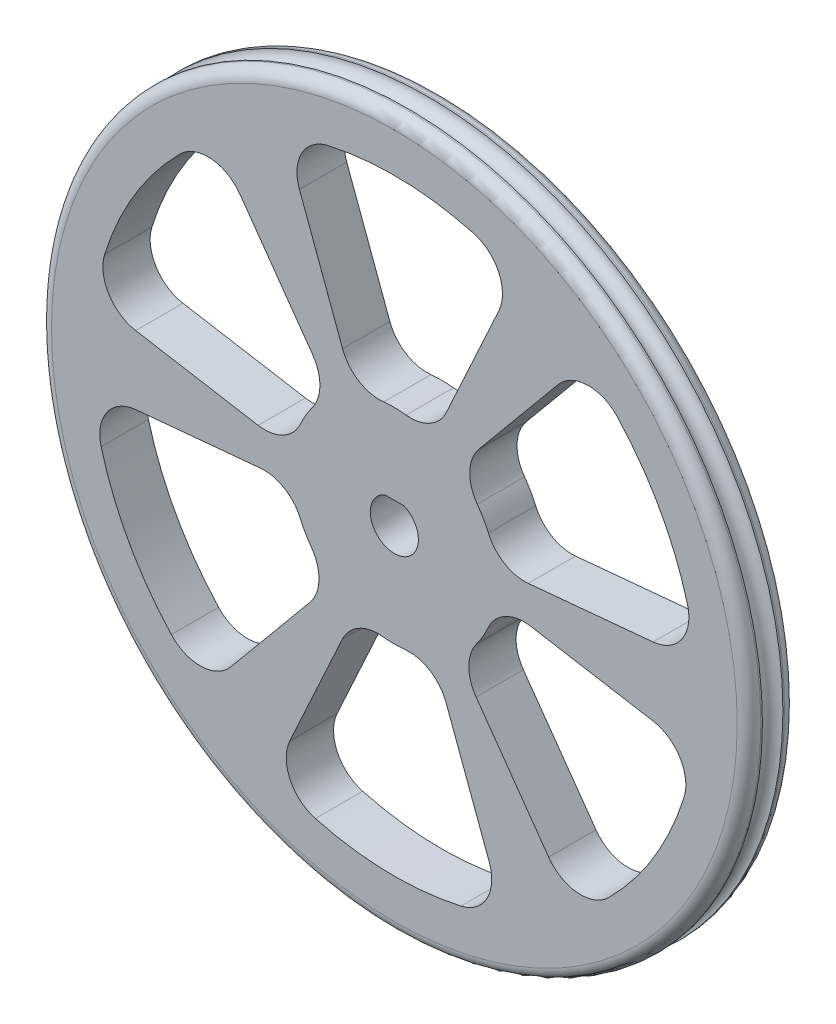
from build123d import *

# Parameters (mm, degrees)
ENL_V_MAT_EXTRU_3_DEPTH      = 64.710281815
ENL_V_MAT_EXTRU_3_DEPTH_BACK = 64.710281815
ENL_V_MAT_EXTRU_8_DEPTH      = 64.921827328
ENL_V_MAT_EXTRU_8_DEPTH_BACK = 64.921827328


with BuildPart() as part:
    # Esquisse2 → Révolution1 (revolve)
    with BuildSketch(Plane(origin=(0, 0, 0), x_dir=(0, 0, -1), z_dir=(1, 0, 0)), mode=Mode.PRIVATE) as r_volution1_sk:
        with BuildLine():
            Line((3, 0), (-3, 0))
            Line((-3, 0), (-3, 43.5))
            ThreePointArc((-3, 43.5), (-2.560660172, 44.560660172), (-1.5, 45))
            Line((-1.5, 45), (-1.3, 45))
            ThreePointArc((-1.3, 45), (0, 43.7), (1.3, 45))
            Line((1.3, 45), (1.5, 45))
            ThreePointArc((1.5, 45), (2.560660172, 44.560660172), (3, 43.5))
            Line((3, 43.5), (3, 0))
        make_face()
    revolve(r_volution1_sk.sketch.rotate(Axis((0, 0, 77.254476924), (0, 0, -1)), 90), axis=Axis((0, 0, 77.254476924), (0, 0, -1)))

    # Esquisse3 → Enlèv. mat.-Extru.3 (cut, two sides: drawn at the far end of the back side and taken through both)
    with BuildSketch(Plane.XY.offset(-ENL_V_MAT_EXTRU_3_DEPTH_BACK)):
        with BuildLine():
            Line((-1.209338662, 2.8), (1.209338662, 2.8))
            ThreePointArc((1.209338662, 2.8), (0, -3.05), (-1.209338662, 2.8))
        make_face()
    extrude(amount=ENL_V_MAT_EXTRU_3_DEPTH + ENL_V_MAT_EXTRU_3_DEPTH_BACK, mode=Mode.SUBTRACT)

    # Esquisse5 → Enlèv. mat.-Extru.8 (cut, two sides: drawn at the far end of the back side and taken through both)
    with BuildSketch(Plane.XY.offset(3).offset(-ENL_V_MAT_EXTRU_8_DEPTH_BACK)):
        with BuildLine():
            ThreePointArc((-10.434150973, 7.754256475), (-11.222640125, 6.561428855), (-11.875358384, 5.289221422))
            ThreePointArc((-11.875358384, 5.289221422), (-14.082795768, 2.915548976), (-17.282106883, 2.394483639))
            Line((-17.282106883, 2.394483639), (-32.821462414, 5.040473711))
            ThreePointArc((-32.821462414, 5.040473711), (-36.244832016, 7.356172767), (-36.755616081, 11.457516594))
            ThreePointArc((-36.755616081, 11.457516594), (-32.932247903, 19.942844532), (-27.184402598, 27.262763165))
            ThreePointArc((-27.184402598, 27.262763165), (-23.229227503, 28.704072082), (-19.575116576, 26.61403506))
            Line((-19.575116576, 26.61403506), (-10.368441836, 13.6285533))
            ThreePointArc((-10.368441836, 13.6285533), (-9.447598742, 10.680736947), (-10.434150973, 7.754256475))
        make_face()
        with BuildLine():
            ThreePointArc((-11.932458581, -5.159111572), (-11.293684136, -6.438377019), (-10.51827931, -7.639751328))
            ThreePointArc((-10.51827931, -7.639751328), (-9.566337363, -10.738284404), (-10.714737101, -13.769501772))
            Line((-10.714737101, -13.769501772), (-20.775909487, -25.903983384))
            ThreePointArc((-20.775909487, -25.903983384), (-24.493048499, -27.710858898), (-28.300308475, -26.102538961))
            ThreePointArc((-28.300308475, -26.102538961), (-33.73713394, -18.548741022), (-37.202446777, -9.911001654))
            ThreePointArc((-37.202446777, -9.911001654), (-36.473069367, -5.765065087), (-32.835988747, -3.645530707))
            Line((-32.835988747, -3.645530707), (-16.986894292, -2.165057378))
            ThreePointArc((-16.986894292, -2.165057378), (-13.973588898, -2.841492042), (-11.932458581, -5.159111572))
        make_face()
        with BuildLine():
            ThreePointArc((-1.498307609, -12.913368047), (-0.071044011, -12.999805873), (1.357079074, -12.928972751))
            ThreePointArc((1.357079074, -12.928972751), (4.516458405, -13.65383338), (6.567369781, -16.163985411))
            Line((6.567369781, -16.163985411), (12.045552926, -30.944457095))
            ThreePointArc((12.045552926, -30.944457095), (11.751783517, -35.067031665), (8.455307606, -37.560055555))
            ThreePointArc((8.455307606, -37.560055555), (-0.804886037, -38.491585554), (-10.018044179, -37.173764819))
            ThreePointArc((-10.018044179, -37.173764819), (-13.243841863, -34.469137169), (-13.260872171, -30.259565767))
            Line((-13.260872171, -30.259565767), (-6.618452456, -15.793610677))
            ThreePointArc((-6.618452456, -15.793610677), (-4.525990156, -13.522228989), (-1.498307609, -12.913368047))
        make_face()
        with BuildLine():
            ThreePointArc((10.434150973, -7.754256475), (11.222640125, -6.561428855), (11.875358384, -5.289221422))
            ThreePointArc((11.875358384, -5.289221422), (14.082795768, -2.915548976), (17.282106883, -2.394483639))
            Line((17.282106883, -2.394483639), (32.821462414, -5.040473711))
            ThreePointArc((32.821462414, -5.040473711), (36.244832016, -7.356172767), (36.755616081, -11.457516594))
            ThreePointArc((36.755616081, -11.457516594), (32.932247903, -19.942844532), (27.184402598, -27.262763165))
            ThreePointArc((27.184402598, -27.262763165), (23.229227503, -28.704072082), (19.575116576, -26.61403506))
            Line((19.575116576, -26.61403506), (10.368441836, -13.6285533))
            ThreePointArc((10.368441836, -13.6285533), (9.447598742, -10.680736947), (10.434150973, -7.754256475))
        make_face()
        with BuildLine():
            ThreePointArc((11.932458581, 5.159111572), (11.293684136, 6.438377019), (10.51827931, 7.639751328))
            ThreePointArc((10.51827931, 7.639751328), (9.566337363, 10.738284404), (10.714737101, 13.769501772))
            Line((10.714737101, 13.769501772), (20.775909487, 25.903983384))
            ThreePointArc((20.775909487, 25.903983384), (24.493048499, 27.710858898), (28.300308475, 26.102538961))
            ThreePointArc((28.300308475, 26.102538961), (33.73713394, 18.548741022), (37.202446777, 9.911001654))
            ThreePointArc((37.202446777, 9.911001654), (36.473069367, 5.765065087), (32.835988747, 3.645530707))
            Line((32.835988747, 3.645530707), (16.986894292, 2.165057378))
            ThreePointArc((16.986894292, 2.165057378), (13.973588898, 2.841492042), (11.932458581, 5.159111572))
        make_face()
        with BuildLine():
            Line((-12.045552926, 30.944457095), (-6.567369781, 16.163985411))
            ThreePointArc((-6.567369781, 16.163985411), (-4.516458405, 13.65383338), (-1.357079074, 12.928972751))
            ThreePointArc((-1.357079074, 12.928972751), (0.071044011, 12.999805873), (1.498307609, 12.913368047))
            ThreePointArc((1.498307609, 12.913368047), (4.525990156, 13.522228989), (6.618452456, 15.793610677))
            Line((6.618452456, 15.793610677), (13.260872171, 30.259565767))
            ThreePointArc((13.260872171, 30.259565767), (13.243841863, 34.469137169), (10.018044179, 37.173764819))
            ThreePointArc((10.018044179, 37.173764819), (0.804886037, 38.491585554), (-8.455307606, 37.560055555))
            ThreePointArc((-8.455307606, 37.560055555), (-11.751783517, 35.067031665), (-12.045552926, 30.944457095))
        make_face()
    extrude(amount=ENL_V_MAT_EXTRU_8_DEPTH + ENL_V_MAT_EXTRU_8_DEPTH_BACK, mode=Mode.SUBTRACT)


solid = part.part
